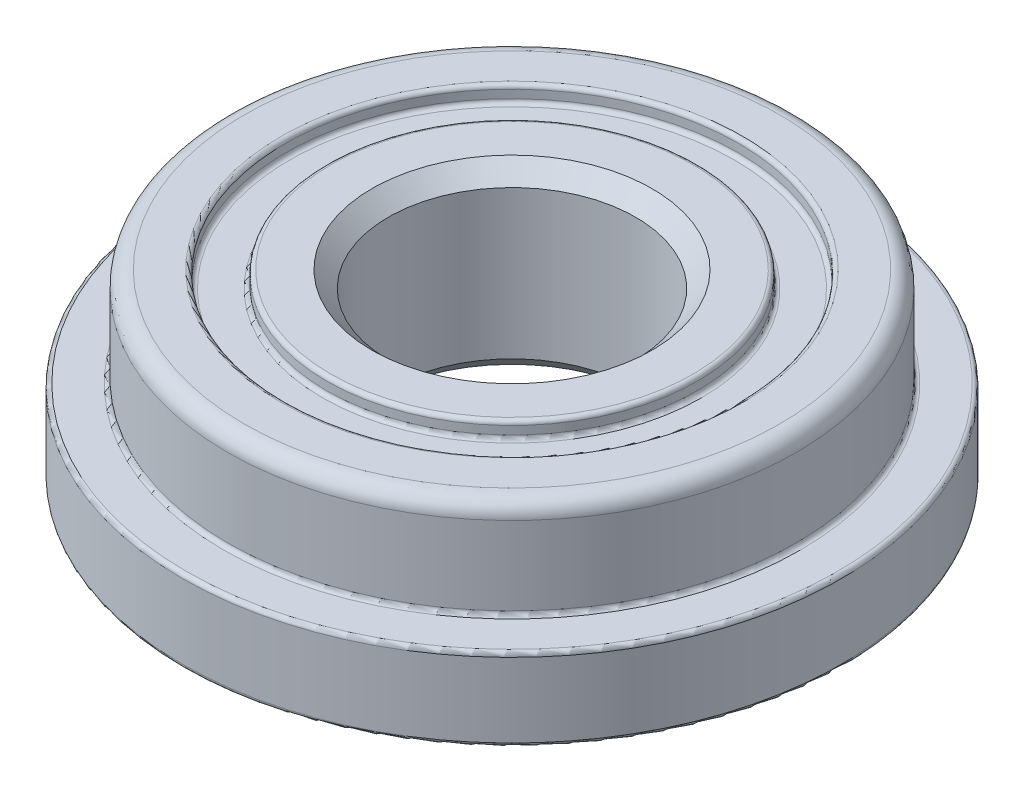
from build123d import *

# Parameters (mm, degrees)
SKETCH1_R           = 4
BOSS_EXTRUDE1_DEPTH = 1
SKETCH3_R           = 3.45
BOSS_EXTRUDE2_DEPTH = 1.2
FILLET1_R           = 0.2
SKETCH4_R           = 1.5
CUT_EXTRUDE1_DEPTH  = 7.069596362
CHAMFER1_SIZE       = 0.2
SKETCH5_R           = 2.75
SKETCH5_R_2         = 2.25
CUT_EXTRUDE2_DEPTH  = 0.2
FILLET2_R           = 0.05
FILLET3_R           = 0.05


with BuildPart() as part:
    # Sketch1 → Boss-Extrude1 (new body)
    with BuildSketch(Plane(origin=(0, 0, 0), x_dir=(1, 0, 0), z_dir=(0, 1, 0))):
        with Locations(Location((0, 0, 0), (0, 0, 270))):
            Circle(SKETCH1_R)
    extrude(amount=BOSS_EXTRUDE1_DEPTH)

    # Sketch3 → Boss-Extrude2 (add)
    with BuildSketch(Plane(origin=(0, 1, 0), x_dir=(1, 0, 0), z_dir=(0, 1, 0))):
        with Locations(Location((0, 0, 0), (0, 0, 270))):
            Circle(SKETCH3_R)
    extrude(amount=BOSS_EXTRUDE2_DEPTH)

    # Fillet1
    fillet1_edges = [part.edges().sort_by_distance(p)[0] for p in [
        (0, 2.2, -3.45),
    ]]
    fillet(fillet1_edges, radius=FILLET1_R)

    # Sketch4 → Cut-Extrude1 (cut, through all)
    with BuildSketch(Plane(origin=(0, 2.2, 0), x_dir=(1, 0, 0), z_dir=(0, 1, 0))):
        with Locations(Location((0, 0, 0), (0, 0, 270))):
            Circle(SKETCH4_R)
    extrude(amount=-CUT_EXTRUDE1_DEPTH, mode=Mode.SUBTRACT)

    # Chamfer1
    chamfer1_edges = [part.edges().sort_by_distance(p)[0] for p in [
        (0, 0, -1.5),
        (0, 2.2, -1.5),
    ]]
    chamfer(chamfer1_edges, length=CHAMFER1_SIZE)

    # Sketch5 → Cut-Extrude2 (cut)
    with BuildSketch(Plane(origin=(0, 2.2, 0), x_dir=(1, 0, 0), z_dir=(0, 1, 0))):
        with Locations(Location((0, 0, 0), (0, 0, 270))):
            Circle(SKETCH5_R)
        with Locations(Location((0, 0, 0), (0, 0, 270))):
            Circle(SKETCH5_R_2, mode=Mode.SUBTRACT)
    extrude(amount=-CUT_EXTRUDE2_DEPTH, mode=Mode.SUBTRACT)

    # Fillet2
    fillet2_edges = [part.edges().sort_by_distance(p)[0] for p in [
        (0, 2, -2.75),
        (0, 2, -2.25),
        (0, 2.2, -2.75),
        (0, 2.2, -2.25),
    ]]
    fillet(fillet2_edges, radius=FILLET2_R)

    # Fillet3
    fillet3_edges = [part.edges().sort_by_distance(p)[0] for p in [
        (0, 0, -4),
        (0, 1, -4),
        (0, 1, -3.45),
    ]]
    fillet(fillet3_edges, radius=FILLET3_R)


solid = part.part
